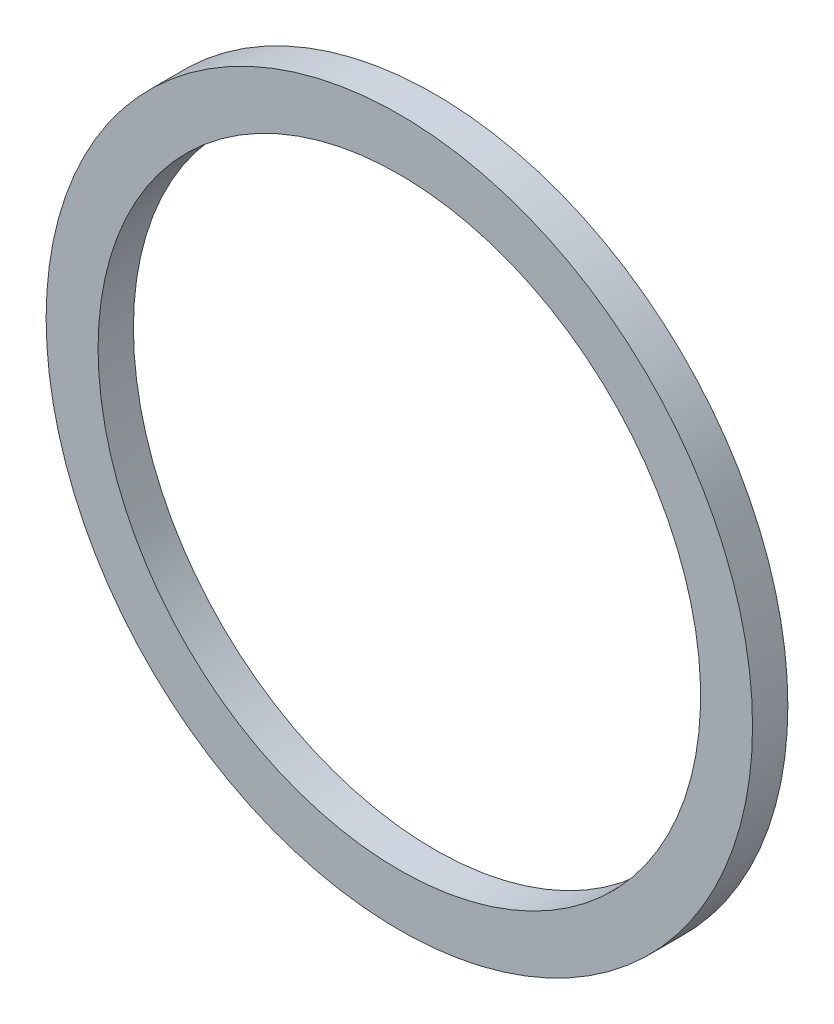
from build123d import *

# Parameters (mm, degrees)
SKETCH_1_R      = 34
SKETCH_1_R_2    = 29
EXTRUDE_1_DEPTH = 3.4


with BuildPart() as part:
    # Эскиз1 → Бобышка-Вытянуть1 (new body)
    with BuildSketch(Plane.XY):
        with Locations(Location((0, 0, 0), (0, 0, 180))):
            Circle(SKETCH_1_R)
        with Locations(Location((0, 0, 0), (0, 0, 180))):
            Circle(SKETCH_1_R_2, mode=Mode.SUBTRACT)
    extrude(amount=EXTRUDE_1_DEPTH)


solid = part.part
